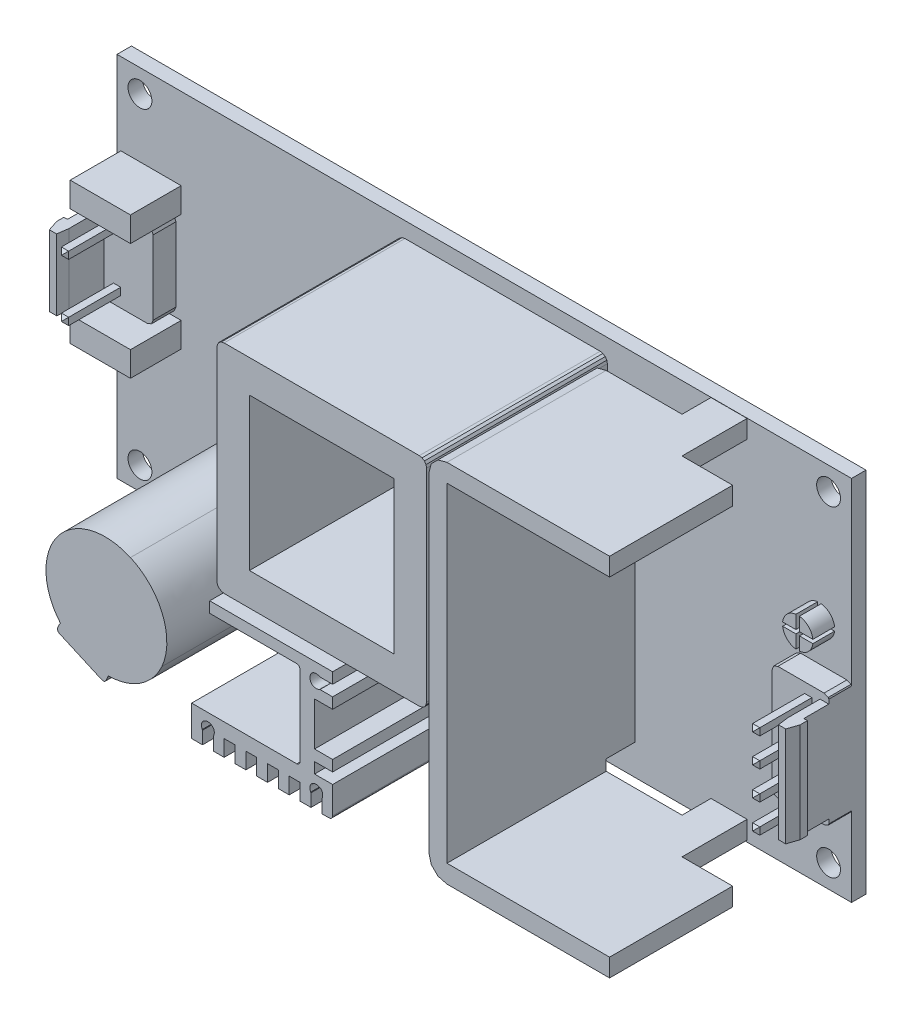
from build123d import *

# Parameters (mm, degrees)
MODEL_W                = 101.6
MODEL_H                = 50.8
MODEL_R                = 1.65
EXTRUDE_650_DEPTH      = 2
EXTRUDE_1121_DEPTH     = 3
CN2_DEPTH              = 3.15
SKETCH9_W              = 0.998434128
SKETCH9_H              = 0.998587317
SKETCH9_H_2            = 0.998332002
CN2_2_DEPTH            = 10.8
CN2_45_SIZE            = 0.45
CN2_START              = -1
CN2_3_DEPTH            = 13.77
EXTRUDE_2461_DEPTH     = 26.02
SKETCH12_W             = 7
SKETCH12_H             = 9
SKETCH12_W_2           = 13
SKETCH12_H_2           = 4
CUT_EXTRUDE_2757_DEPTH = 4
SKETCH13_W             = 7
SKETCH13_H             = 9
SKETCH13_W_2           = 13
SKETCH13_H_2           = 4
CUT_EXTRUDE_3024_DEPTH = 4
SKETCH3_W              = 8.337050073
SKETCH3_H              = 3.434392809
SKETCH3_H_2            = 3.434341745
FS1_FS2_DEPTH          = 7.01
CN1_DEPTH              = 3.15
SKETCH15_W             = 0.998434128
SKETCH15_H             = 0.998434128
SKETCH15_H_2           = 1.006604202
CN1_2_DEPTH            = 10.8
CN1_45_SIZE            = 0.45
CN1_3_DEPTH            = 9.805620907
EXTRUDE_4049_DEPTH     = 26.01
CUT_EXTRUDE_4590_REACH = 118.967
SKETCH17_W             = 1.25
SKETCH17_H             = 2
SKETCH17_W_2           = 2.25
SKETCH17_W_3           = 0.45
SKETCH17_W_4           = 6.45
SKETCH17_W_5           = 2.05
EXTRUDE_4650_DEPTH     = 26.01
SKETCH6_W              = 19.998299079
SKETCH6_H              = 21.014452055
EXTRUDE_4712_DEPTH     = 25.01


with BuildPart() as part:
    # Model → Extrude 650 (new body)
    with BuildSketch(Plane.XY):
        with Locations((50.8, 25.4)):
            Rectangle(MODEL_W, MODEL_H)
        with Locations((98.425, 3.175)):
            Circle(MODEL_R, mode=Mode.SUBTRACT)
        with Locations((3.175, 47.625)):
            Circle(MODEL_R, mode=Mode.SUBTRACT)
        with Locations((3.175, 3.175)):
            Circle(MODEL_R, mode=Mode.SUBTRACT)
        with Locations((98.425, 47.625)):
            Circle(MODEL_R, mode=Mode.SUBTRACT)
    extrude(amount=-EXTRUDE_650_DEPTH)

    # Sketch2 → Extrude 1121 (add)
    with BuildSketch(Plane.XY):
        with BuildLine():
            Line((95.070390832, 31.333073281), (96.905332036, 31.333073281))
            Line((96.905332036, 31.333073281), (96.905332036, 29.501480892))
            ThreePointArc((96.905332036, 29.501480892), (95.672823058, 30.101662707), (95.070390832, 31.333073281))
        make_face()
        with BuildLine():
            Line((95.06939151, 31.844724176), (96.905332036, 31.844724176))
            Line((96.905332036, 31.844724176), (96.905332036, 33.684486639))
            ThreePointArc((96.905332036, 33.684486639), (95.669913156, 33.081394554), (95.06939151, 31.844724176))
        make_face()
        with BuildLine():
            Line((97.392472709, 33.687400705), (97.392472709, 31.844724176))
            Line((97.392472709, 31.844724176), (99.253453326, 31.844724176))
            ThreePointArc((99.253453326, 31.844724176), (98.644001509, 33.090289944), (97.392472709, 33.687400705))
        make_face()
        with BuildLine():
            Line((97.392472709, 29.498566826), (97.392472709, 31.333073281))
            Line((97.392472709, 31.333073281), (99.252454004, 31.333073281))
            ThreePointArc((99.252454004, 31.333073281), (98.64107425, 30.092784775), (97.392472709, 29.498566826))
        make_face()
    extrude(amount=EXTRUDE_1121_DEPTH)

    # Sketch8 → CN2 (add)
    with BuildSketch(Plane.XY):
        Polygon((94.560010116, 10.569340377), (100.956667571, 10.569340377), (101.524998356, 10.804740639), (101.6, 10.985818361), (101.6, 25.92570123), (101.524998356, 26.106778952), (100.956667571, 26.342179215), (94.560010116, 26.342179215), (93.99167933, 26.106778952), (93.756279068, 25.538448167), (93.756279068, 11.373071424), (93.99167933, 10.804740639), align=None)
    extrude(amount=CN2_DEPTH)

    # Sketch9 → CN2 2 (add)
    with BuildSketch(Plane.XY):
        Polygon((98.26105372, 12.061910804), (99.259487848, 12.061910804), (99.259334659, 13.060191743), (98.26105372, 13.060344932), align=None)
        Polygon((98.26105372, 23.946304961), (99.259487848, 23.946304961), (99.259334659, 24.9445859), (98.26105372, 24.944739089), align=None)
        with Locations((98.760270784, 20.484133901)):
            Rectangle(SKETCH9_W, SKETCH9_H)
        with Locations((98.760270784, 16.523052154)):
            Rectangle(SKETCH9_W, SKETCH9_H_2)
    extrude(amount=CN2_2_DEPTH)

    # CN2 вывод контакты-45гр
    cn2_45_edges = [part.edges().sort_by_distance(p)[0] for p in [
        (99.259411254, 24.445445431, 10.8),
        (98.76019419, 24.944662495, 10.8),
        (98.26105372, 24.445522025, 10.8),
        (98.760270784, 23.946304961, 10.8),
        (99.259487848, 20.4841339, 10.8),
        (98.760270784, 20.983427559, 10.8),
        (98.26105372, 20.4841339, 10.8),
        (98.760270784, 19.984840242, 10.8),
        (98.760270784, 16.023886153, 10.8),
        (99.259487848, 16.523052154, 10.8),
        (98.760270784, 17.022218155, 10.8),
        (98.26105372, 16.523052154, 10.8),
        (99.259411254, 12.561051273, 10.8),
        (98.76019419, 13.060268337, 10.8),
        (98.26105372, 12.561127868, 10.8),
        (98.760270784, 12.061910804, 10.8),
    ]]
    chamfer(cn2_45_edges, length=CN2_45_SIZE)

    # Sketch11 → CN2 3 (add)
    with BuildSketch(Plane.XZ.offset(-10.569340377).offset(CN2_START)):
        Polygon((100.4, 3.15), (101.6, 3.15), (101.6, 6.6), (102.1, 6.6), (102.1, 7.6), (101.6, 9.1), (100.6, 9.1), (100.4, 7.6), align=None)
    extrude(amount=-CN2_3_DEPTH)

    # Sketch7 → Extrude 2461 (add)
    with BuildSketch(Plane.XY):
        Polygon((71.659802813, 48.267594542), (71.659802813, 2.743941199), (94.154059555, 2.743941199), (94.154059555, 0.24338787), (71.659802813, 0.24338787), (70.409781463, 0.576318393), (69.492690636, 1.49340922), (69.159760113, 2.74343057), (69.159760113, 48.267594542), (69.492180007, 49.517615891), (70.409781463, 50.434706718), (71.659802813, 50.767126612), (94.154059555, 50.767126612), (94.154059555, 48.267594542), align=None)
    extrude(amount=EXTRUDE_2461_DEPTH)

    # Sketch12 → Cut-Extrude 2757 (cut)
    with BuildSketch(Plane.XZ.offset(-0.24338787)):
        with Locations((90.654059555, 4.5)):
            Rectangle(SKETCH12_W, SKETCH12_H)
        with Locations((75.659760113, 2)):
            Rectangle(SKETCH12_W_2, SKETCH12_H_2)
    extrude(amount=-CUT_EXTRUDE_2757_DEPTH, mode=Mode.SUBTRACT)

    # Sketch13 → Cut-Extrude 3024 (cut)
    with BuildSketch(Plane(origin=(0, 50.767126612, 0), x_dir=(1, 0, 0), z_dir=(0, 1, 0))):
        with Locations((90.654059555, -4.5)):
            Rectangle(SKETCH13_W, SKETCH13_H)
        with Locations((75.659760113, -2)):
            Rectangle(SKETCH13_W_2, SKETCH13_H_2)
    extrude(amount=-CUT_EXTRUDE_3024_DEPTH, mode=Mode.SUBTRACT)

    # Sketch3 → предохранители fs1-fs2 (add)
    with BuildSketch(Plane.XY):
        with Locations((4.704768318, 37.789014837)):
            Rectangle(SKETCH3_W, SKETCH3_H)
        with Locations((4.704768318, 21.650080081)):
            Rectangle(SKETCH3_W, SKETCH3_H_2)
    extrude(amount=FS1_FS2_DEPTH)

    # Sketch14 → CN1 (add)
    with BuildSketch(Plane.XY):
        Polygon((0.159909239, 34.621017509), (0.159909239, 34.824248105), (0.395309501, 35.384408816), (0.955470212, 35.619809078), (7.360297741, 35.619809078), (7.920458452, 35.384408816), (8.155858715, 34.824248105), (8.155858715, 24.612166007), (7.920458452, 24.052005296), (7.360297741, 23.816605033), (0.955470212, 23.816605033), (0.395309501, 24.052005296), (0.159909239, 24.612166007), (0.159909239, 24.815396602), (1.361318647, 24.815396602), (1.361318647, 34.621017509), align=None)
    extrude(amount=CN1_DEPTH)

    # Sketch15 → CN1 2 (add)
    with BuildSketch(Plane.XY):
        with Locations((3.159526443, 33.732343222)):
            Rectangle(SKETCH15_W, SKETCH15_H)
        with Locations((3.159526443, 25.805328747)):
            Rectangle(SKETCH15_W, SKETCH15_H_2)
    extrude(amount=CN1_2_DEPTH)

    # CN1 вывод контакты-45гр
    cn1_45_edges = [part.edges().sort_by_distance(p)[0] for p in [
        (2.660309379, 25.805328747, 10.8),
        (3.159526443, 25.302026646, 10.8),
        (3.658743507, 25.805328747, 10.8),
        (3.159526443, 26.308630848, 10.8),
        (3.159526443, 34.231560286, 10.8),
        (2.660309379, 33.732343222, 10.8),
        (3.159526443, 33.233126158, 10.8),
        (3.658743507, 33.732343222, 10.8),
    ]]
    chamfer(cn1_45_edges, length=CN1_45_SIZE)

    # Sketch16 → CN1 3 (add)
    with BuildSketch(Plane(origin=(0, 24.815396602, 0), x_dir=(1, 0, 0), z_dir=(0, 1, 0))):
        Polygon((1.359909239, 0), (1.359909239, -8.01), (1.159909239, -9.51), (0.159909239, -9.51), (-0.340090761, -8.01), (-0.340090761, -7.01), (0.159909239, -7.01), (0.159909239, 0), align=None)
    extrude(amount=CN1_3_DEPTH)

    # Sketch5 → Extrude 4049 (add)
    with BuildSketch(Plane.XY):
        with BuildLine():
            Line((38.833466009, 17.763090694), (55.834369123, 17.763090694))
            Line((55.834369123, 17.763090694), (55.834369123, 16.260818304))
            Line((55.834369123, 16.260818304), (54.081888211, 16.260818304))
            Line((54.081888211, 16.260818304), (54.010400061, 16.302689934))
            add(Edge.make_bspline(
                [(54.010400061, 16.302689934), (52.264557335, 16.95425335), (52.265067964, 14.070727793), (54.010400061, 14.717184913)],
                knots=[0, 0, 0, 0, 1, 1, 1, 1], degree=3))
            Line((54.010400061, 14.717184913), (54.081888211, 14.758545914))
            Line((54.081888211, 14.758545914), (55.834369123, 14.758545914))
            Line((55.834369123, 14.758545914), (55.834369123, 13.262401079))
            Line((55.834369123, 13.262401079), (53.333815793, 13.262401079))
            Line((53.333815793, 13.262401079), (53.333815793, 7.258928444))
            Line((53.333815793, 7.258928444), (55.834369123, 7.258928444))
            Line((55.834369123, 7.258928444), (55.834369123, 5.756145424))
            Line((55.834369123, 5.756145424), (53.333815793, 5.756145424))
            Line((53.333815793, 5.756145424), (53.333815793, 4.26000059))
            Line((53.333815793, 4.26000059), (55.834369123, 4.26000059))
            Line((55.834369123, 4.26000059), (55.834369123, 0.507383392))
            Line((55.834369123, 0.507383392), (55.828241567, 0.45376728))
            add(Edge.make_bspline(
                [(55.38910008, 0.008498237), (55.610713342, 0.039136015), (55.814965196, 0.223983944), (55.828241567, 0.45376728)],
                knots=[0, 0, 0, 0, 1, 1, 1, 1], degree=3))
            Line((55.38910008, 0.008498237), (55.334973338, 0.008498237))
            Line((55.334973338, 0.008498237), (54.331586103, 0.008498237))
            Line((54.331586103, 0.008498237), (54.331586103, 1.76046852))
            Line((54.331586103, 1.76046852), (54.372947103, 1.825829113))
            add(Edge.make_bspline(
                [(54.372947103, 1.825829113), (55.02399989, 3.582905692), (52.137921185, 3.580863173), (52.793569638, 1.825829113)],
                knots=[0, 0, 0, 0, 1, 1, 1, 1], degree=3))
            Line((52.793569638, 1.825829113), (52.835441268, 1.76046852))
            Line((52.835441268, 1.76046852), (52.835441268, 0.008498237))
            Line((52.835441268, 0.008498237), (51.332658248, 0.008498237))
            Line((51.332658248, 0.008498237), (51.332658248, 2.258843045))
            Line((51.332658248, 2.258843045), (49.830385858, 2.258843045))
            Line((49.830385858, 2.258843045), (49.830385858, 0.008498237))
            Line((49.830385858, 0.008498237), (48.334241023, 0.008498237))
            Line((48.334241023, 0.008498237), (48.334241023, 2.258843045))
            Line((48.334241023, 2.258843045), (46.831968633, 2.258843045))
            Line((46.831968633, 2.258843045), (46.831968633, 0.008498237))
            Line((46.831968633, 0.008498237), (45.335823799, 0.008498237))
            Line((45.335823799, 0.008498237), (45.335823799, 2.258843045))
            Line((45.335823799, 2.258843045), (43.833040779, 2.258843045))
            Line((43.833040779, 2.258843045), (43.833040779, 0.008498237))
            Line((43.833040779, 0.008498237), (42.331279018, 0.008498237))
            Line((42.331279018, 0.008498237), (42.331279018, 2.258843045))
            Line((42.331279018, 2.258843045), (40.834623554, 2.258843045))
            Line((40.834623554, 2.258843045), (40.834623554, 0.008498237))
            Line((40.834623554, 0.008498237), (39.331840534, 0.008498237))
            Line((39.331840534, 0.008498237), (39.331840534, 1.76046852))
            Line((39.331840534, 1.76046852), (39.373201535, 1.825829113))
            add(Edge.make_bspline(
                [(39.373201535, 1.825829113), (40.02578621, 3.584437581), (37.138686246, 3.578820655), (37.793824069, 1.825829113)],
                knots=[0, 0, 0, 0, 1, 1, 1, 1], degree=3))
            Line((37.793824069, 1.825829113), (37.8356957, 1.76046852))
            Line((37.8356957, 1.76046852), (37.8356957, 0.008498237))
            Line((37.8356957, 0.008498237), (36.333423309, 0.008498237))
            Line((36.333423309, 0.008498237), (36.333423309, 4.26000059))
            Line((36.333423309, 4.26000059), (50.834283723, 4.26000059))
            Line((50.834283723, 4.26000059), (50.887389205, 4.26000059))
            add(Edge.make_bspline(
                [(50.887389205, 4.26000059), (51.122278838, 4.289106479), (51.298446063, 4.465784333), (51.332658248, 4.699652707)],
                knots=[0, 0, 0, 0, 1, 1, 1, 1], degree=3))
            Line((51.332658248, 4.699652707), (51.332658248, 4.758885744))
            Line((51.332658248, 4.758885744), (51.332658248, 15.762443779))
            Line((51.332658248, 15.762443779), (51.332658248, 15.815549261))
            add(Edge.make_bspline(
                [(51.332658248, 15.815549261), (51.306105507, 16.039205042), (51.117172542, 16.242435637), (50.887389205, 16.255201378)],
                knots=[0, 0, 0, 0, 1, 1, 1, 1], degree=3))
            Line((50.887389205, 16.255201378), (50.834283723, 16.260818304))
            Line((50.834283723, 16.260818304), (38.833466009, 16.260818304))
            Line((38.833466009, 16.260818304), (38.833466009, 17.763090694))
        make_face()
    extrude(amount=EXTRUDE_4049_DEPTH)

    # Cut-Extrude 4590: up to this face of the body (flat: up to its plane)
    cut_extrude_4590_end = Plane(part.part.faces().sort_by_distance((47.333917566, 17.763090694, 13.005))[0])
    # Sketch17 → Cut-Extrude 4590 (cut, up to the picked face)
    with BuildSketch(Plane.XZ.offset(-0.008498237), mode=Mode.PRIVATE) as cut_extrude_4590_sk1:
        with Locations((36.958423309, 1)):
            Rectangle(SKETCH17_W, SKETCH17_H)
    cut_extrude_4590_tool1 = split(extrude(cut_extrude_4590_sk1.sketch, amount=-CUT_EXTRUDE_4590_REACH, mode=Mode.PRIVATE), bisect_by=cut_extrude_4590_end, keep=Keep.BOTH, mode=Mode.PRIVATE)
    # Sketch17 → Cut-Extrude 4590 (cut, up to the picked face)
    with BuildSketch(Plane.XZ.offset(-0.008498237), mode=Mode.PRIVATE) as cut_extrude_4590_sk2:
        with Locations((40.708423309, 1)):
            Rectangle(SKETCH17_W_2, SKETCH17_H)
    cut_extrude_4590_tool2 = split(extrude(cut_extrude_4590_sk2.sketch, amount=-CUT_EXTRUDE_4590_REACH, mode=Mode.PRIVATE), bisect_by=cut_extrude_4590_end, keep=Keep.BOTH, mode=Mode.PRIVATE)
    # Sketch17 → Cut-Extrude 4590 (cut, up to the picked face)
    with BuildSketch(Plane.XZ.offset(-0.008498237), mode=Mode.PRIVATE) as cut_extrude_4590_sk3:
        with Locations((42.858423309, 1)):
            Rectangle(SKETCH17_W_3, SKETCH17_H)
    cut_extrude_4590_tool3 = split(extrude(cut_extrude_4590_sk3.sketch, amount=-CUT_EXTRUDE_4590_REACH, mode=Mode.PRIVATE), bisect_by=cut_extrude_4590_end, keep=Keep.BOTH, mode=Mode.PRIVATE)
    # Sketch17 → Cut-Extrude 4590 (cut, up to the picked face)
    with BuildSketch(Plane.XZ.offset(-0.008498237), mode=Mode.PRIVATE) as cut_extrude_4590_sk4:
        with Locations((49.358423309, 1)):
            Rectangle(SKETCH17_W_4, SKETCH17_H)
    cut_extrude_4590_tool4 = split(extrude(cut_extrude_4590_sk4.sketch, amount=-CUT_EXTRUDE_4590_REACH, mode=Mode.PRIVATE), bisect_by=cut_extrude_4590_end, keep=Keep.BOTH, mode=Mode.PRIVATE)
    # Sketch17 → Cut-Extrude 4590 (cut, up to the picked face)
    with BuildSketch(Plane.XZ.offset(-0.008498237), mode=Mode.PRIVATE) as cut_extrude_4590_sk5:
        with Locations((55.608423309, 1)):
            Rectangle(SKETCH17_W_5, SKETCH17_H)
    cut_extrude_4590_tool5 = split(extrude(cut_extrude_4590_sk5.sketch, amount=-CUT_EXTRUDE_4590_REACH, mode=Mode.PRIVATE), bisect_by=cut_extrude_4590_end, keep=Keep.BOTH, mode=Mode.PRIVATE)
    add(cut_extrude_4590_tool1.solids().sort_by(Axis((36.958423, 0.008498, 1), (0, 1, 0)))[0], mode=Mode.SUBTRACT)
    add(cut_extrude_4590_tool2.solids().sort_by(Axis((40.708423, 0.008498, 1), (0, 1, 0)))[0], mode=Mode.SUBTRACT)
    add(cut_extrude_4590_tool3.solids().sort_by(Axis((42.858423, 0.008498, 1), (0, 1, 0)))[0], mode=Mode.SUBTRACT)
    add(cut_extrude_4590_tool4.solids().sort_by(Axis((49.358423, 0.008498, 1), (0, 1, 0)))[0], mode=Mode.SUBTRACT)
    add(cut_extrude_4590_tool5.solids().sort_by(Axis((55.608423, 0.008498, 1), (0, 1, 0)))[0], mode=Mode.SUBTRACT)

    # Sketch4 → Extrude 4650 (add)
    with BuildSketch(Plane.XY):
        with BuildLine():
            Line((18.024287067, 4.515826038), (17.818132619, 4.053123832))
            ThreePointArc((17.818132619, 4.053123832), (17.808832355, 3.69919132), (18.052612816, 3.442431111))
            Line((18.052612816, 3.442431111), (23.902656633, 0.837760236))
            ThreePointArc((23.902656633, 0.837760236), (24.256424359, 0.829373471), (24.512802829, 1.073283335))
            Line((24.512802829, 1.073283335), (24.718134382, 1.535279331))
            ThreePointArc((24.718134382, 1.535279331), (24.75171186, 1.645419277), (24.756431605, 1.760467001))
            ThreePointArc((24.756431605, 1.760467001), (29.19232611, 3.065192337), (32.211110255, 6.567535917))
            add(Edge.make_bspline(
                [(27.871268975, 17.46028732), (32.107452439, 15.574532073), (34.049887575, 10.697508416), (32.211110255, 6.567535917)],
                knots=[0, 0, 0, 0, 1, 1, 1, 1], degree=3))
            add(Edge.make_bspline(
                [(16.872306608, 13.396696673), (18.711083928, 17.527179802), (23.635596142, 19.346042567), (27.871268975, 17.46028732)],
                knots=[0, 0, 0, 0, 1, 1, 1, 1], degree=3))
            ThreePointArc((16.872306608, 13.396696673), (16.279964776, 8.86613989), (18.212198774, 4.725694818))
            ThreePointArc((18.212198774, 4.725694818), (18.101563283, 4.635694994), (18.024287067, 4.515826038))
        make_face()
    extrude(amount=EXTRUDE_4650_DEPTH)

    # Sketch6 → Extrude 4712 (add)
    with BuildSketch(Plane.XY):
        Polygon((38.832955379, 47.657392126), (38.832955379, 19.628931385), (38.896273454, 19.241874121), (39.120439865, 18.91966682), (39.420690091, 18.743499596), (39.82970443, 18.632182335), (41.860989123, 18.632182335), (66.832310231, 18.632182335), (67.230090718, 18.727670077), (67.531872833, 18.91966682), (67.744805391, 19.241874121), (67.829059281, 19.628931385), (67.829059281, 47.657392126), (67.753486095, 48.041385613), (67.531872833, 48.366656691), (67.196899791, 48.568866027), (66.832310231, 48.652268391), (39.8291938, 48.652268391), (39.430902684, 48.554057768), (39.119929235, 48.366656691), (38.917719899, 48.012279723), align=None)
        with Locations((53.326156349, 33.643161756)):
            Rectangle(SKETCH6_W, SKETCH6_H, mode=Mode.SUBTRACT)
    extrude(amount=EXTRUDE_4712_DEPTH)


solid = part.part
